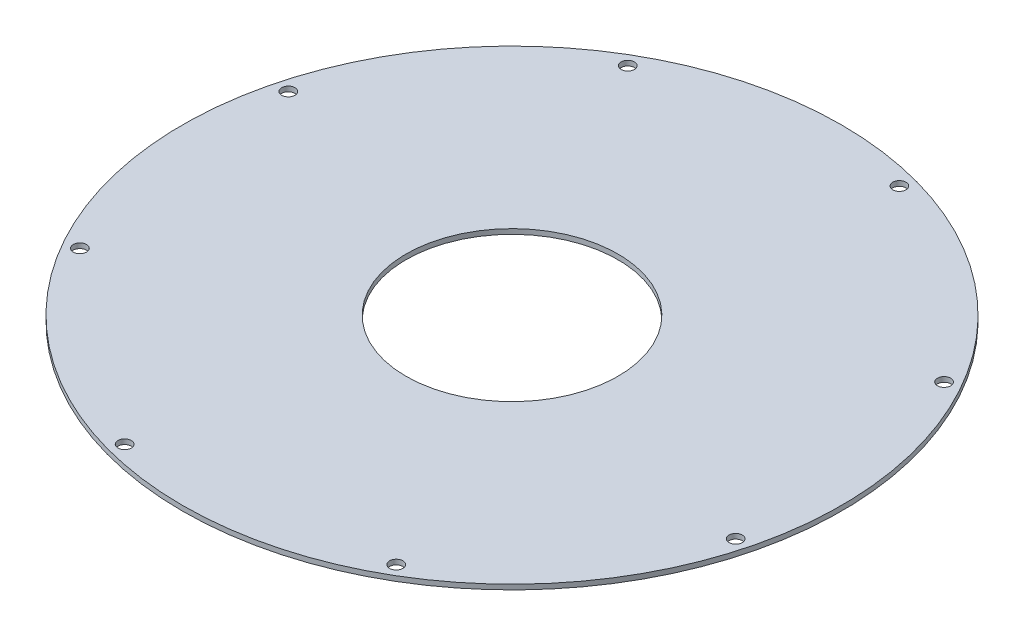
from build123d import *

# Parameters (mm, degrees)
SKETCH1_R                     = 99.5
SKETCH1_R_2                   = 32
BASE_DEPTH                    = 0.75
SKETCH2_R                     = 2
STRUCTURAL_HOLE_DEPTH         = 141.722244155
STRUCTURAL_HOLE_PATTERN_COUNT = 8


with BuildPart() as part:
    # Sketch1 → Base (new, symmetric)
    with BuildSketch(Plane(origin=(0, 0, 0), x_dir=(1, 0, 0), z_dir=(0, 1, 0))):
        with Locations(Location((0, 0, 0), (0, 0, 270))):
            Circle(SKETCH1_R)
        with Locations(Location((0, 0, 0), (0, 0, 270))):
            Circle(SKETCH1_R_2, mode=Mode.SUBTRACT)
    extrude(amount=BASE_DEPTH, both=True)

    # Sketch2 → Structural Hole (cut, through all)
    with BuildSketch(Plane(origin=(0, 0.75, 0), x_dir=(1, 0, 0), z_dir=(0, 1, 0))):
        with Locations(Location((24.717218807, 92.245916411, 0), (0, 0, 270))):
            Circle(SKETCH2_R)
    structural_hole = extrude(amount=-STRUCTURAL_HOLE_DEPTH, mode=Mode.SUBTRACT)

    # Structural Hole Pattern: Structural Hole ×8 about axis
    structural_hole_pattern_axis = Axis((0, 0, 0), (0, 1, 0))
    for i in range(1, STRUCTURAL_HOLE_PATTERN_COUNT):
        add(structural_hole.rotate(structural_hole_pattern_axis, i * 360 / STRUCTURAL_HOLE_PATTERN_COUNT), mode=Mode.SUBTRACT)


solid = part.part
